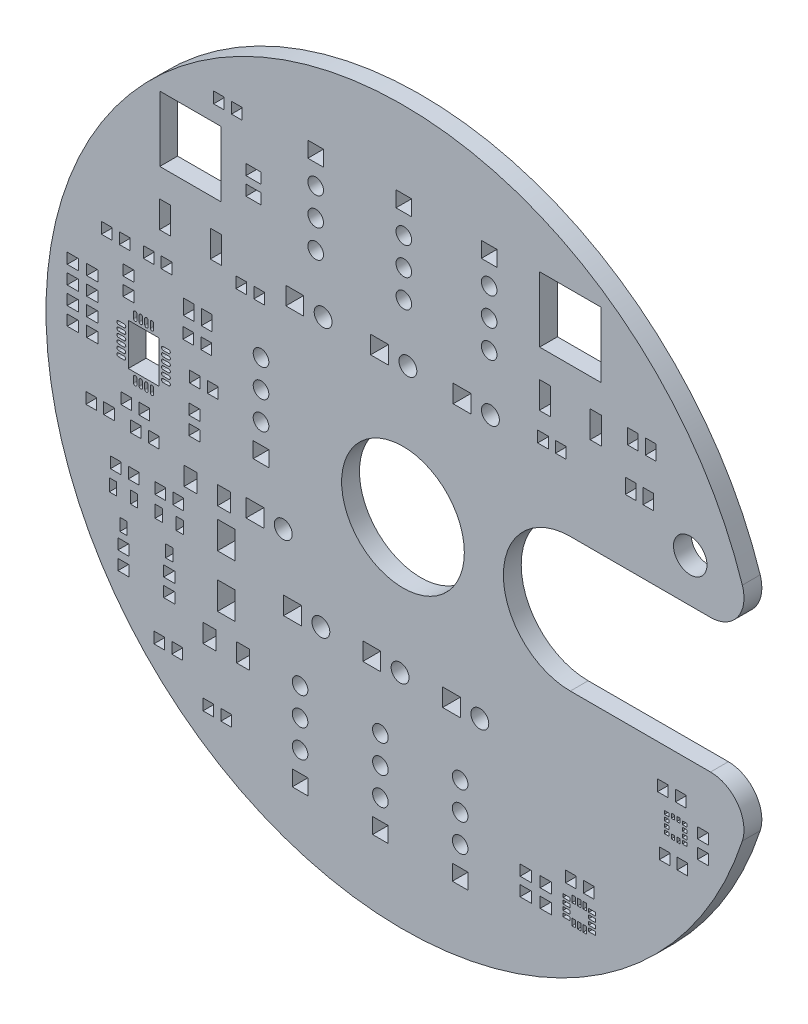
from build123d import *

# Parameters (mm, degrees)
MODEL_R            = 1.5
MODEL_R_2          = 0.7
MODEL_R_3          = 0.8
MODEL_R_4          = 5.5
MODEL_W            = 0.4
MODEL_H            = 0.3
MODEL_W_2          = 0.3
MODEL_H_2          = 0.4
MODEL_W_3          = 0.6
MODEL_H_3          = 0.6
MODEL_W_4          = 0.95
MODEL_H_4          = 1.35
MODEL_W_5          = 2.75
MODEL_H_5          = 3.75
MODEL_W_6          = 0.65
MODEL_H_6          = 1.1
MODEL_W_7          = 1.35
MODEL_H_7          = 0.95
MODEL_W_8          = 1
MODEL_H_8          = 2.4
MODEL_W_9          = 5.5
MODEL_H_9          = 5.85
MODEL_H_10         = 1
MODEL_W_10         = 1.15
MODEL_H_11         = 1.65
MODEL_W_11         = 1.55
MODEL_H_12         = 2.45
MODEL_W_12         = 1.4
MODEL_H_13         = 1.4
MODEL_W_13         = 1.6
MODEL_H_14         = 1.6
BOSS_EXTRU_1_DEPTH = 1.6


with BuildPart() as part:
    # Model → Boss.-Extru.1 (new body)
    with BuildSketch(Plane.XY):
        with BuildLine():
            Line((27.5681, -6), (15, -6))
            ThreePointArc((15, -6), (9, 0), (15, 6))
            Line((15, 6), (27.5681, 6))
            ThreePointArc((27.5681, 6), (29.996378345, 7.238321112), (30.42, 9.931))
            ThreePointArc((30.42, 9.931), (-32.000018141, 0), (30.42, -9.931))
            ThreePointArc((30.42, -9.931), (29.996378346, -7.238321112), (27.5681, -6))
        make_face()
        with Locations((25.75, 9.9)):
            Circle(MODEL_R, mode=Mode.SUBTRACT)
        with Locations((-12.725, 1.025)):
            Circle(MODEL_R_2, mode=Mode.SUBTRACT)
        with Locations((-12.725, 3.525)):
            Circle(MODEL_R_2, mode=Mode.SUBTRACT)
        with Locations((-12.725, 6.025)):
            Circle(MODEL_R_2, mode=Mode.SUBTRACT)
        with Locations((-9.225, -22.7)):
            Circle(MODEL_R_2, mode=Mode.SUBTRACT)
        with Locations((-9.225, -20.2)):
            Circle(MODEL_R_2, mode=Mode.SUBTRACT)
        with Locations((-9.225, -17.7)):
            Circle(MODEL_R_2, mode=Mode.SUBTRACT)
        with Locations((5.125, -22.85)):
            Circle(MODEL_R_2, mode=Mode.SUBTRACT)
        with Locations((5.125, -20.35)):
            Circle(MODEL_R_2, mode=Mode.SUBTRACT)
        with Locations((5.125, -17.85)):
            Circle(MODEL_R_2, mode=Mode.SUBTRACT)
        with Locations((-2.025, -22.8001)):
            Circle(MODEL_R_2, mode=Mode.SUBTRACT)
        with Locations((-2.025, -20.3001)):
            Circle(MODEL_R_2, mode=Mode.SUBTRACT)
        with Locations((-2.025, -17.8001)):
            Circle(MODEL_R_2, mode=Mode.SUBTRACT)
        with Locations((-7.825, 21.7999)):
            Circle(MODEL_R_2, mode=Mode.SUBTRACT)
        with Locations((-7.825, 19.2999)):
            Circle(MODEL_R_2, mode=Mode.SUBTRACT)
        with Locations((-7.825, 16.7999)):
            Circle(MODEL_R_2, mode=Mode.SUBTRACT)
        with Locations((7.725, 21.8)):
            Circle(MODEL_R_2, mode=Mode.SUBTRACT)
        with Locations((7.725, 19.3)):
            Circle(MODEL_R_2, mode=Mode.SUBTRACT)
        with Locations((7.725, 16.8)):
            Circle(MODEL_R_2, mode=Mode.SUBTRACT)
        with Locations((0.075, 21.9)):
            Circle(MODEL_R_2, mode=Mode.SUBTRACT)
        with Locations((0.075, 19.4)):
            Circle(MODEL_R_2, mode=Mode.SUBTRACT)
        with Locations((0.075, 16.9)):
            Circle(MODEL_R_2, mode=Mode.SUBTRACT)
        with Locations((6.89, -12.2)):
            Circle(MODEL_R_3, mode=Mode.SUBTRACT)
        with Locations((-0.26, -12.2)):
            Circle(MODEL_R_3, mode=Mode.SUBTRACT)
        with Locations((-7.36, -12.2)):
            Circle(MODEL_R_3, mode=Mode.SUBTRACT)
        with Locations((-7.16, 11.95)):
            Circle(MODEL_R_3, mode=Mode.SUBTRACT)
        with Locations((0.44, 11.95)):
            Circle(MODEL_R_3, mode=Mode.SUBTRACT)
        with Locations((7.84, 11.85)):
            Circle(MODEL_R_3, mode=Mode.SUBTRACT)
        with Locations((-10.73, -6.3)):
            Circle(MODEL_R_3, mode=Mode.SUBTRACT)
        Circle(MODEL_R_4, mode=Mode.SUBTRACT)
        with Locations((25.25, -12.7)):
            Rectangle(MODEL_W, MODEL_H, mode=Mode.SUBTRACT)
        with Locations((25.25, -12.2)):
            Rectangle(MODEL_W, MODEL_H, mode=Mode.SUBTRACT)
        with Locations((25.25, -11.7)):
            Rectangle(MODEL_W, MODEL_H, mode=Mode.SUBTRACT)
        with Locations((25.25, -11.2)):
            Rectangle(MODEL_W, MODEL_H, mode=Mode.SUBTRACT)
        with Locations((24.7, -11.15)):
            Rectangle(MODEL_W_2, MODEL_H_2, mode=Mode.SUBTRACT)
        with Locations((24.2, -11.15)):
            Rectangle(MODEL_W_2, MODEL_H_2, mode=Mode.SUBTRACT)
        with Locations((23.65, -11.2)):
            Rectangle(MODEL_W, MODEL_H, mode=Mode.SUBTRACT)
        with Locations((23.65, -11.7)):
            Rectangle(MODEL_W, MODEL_H, mode=Mode.SUBTRACT)
        with Locations((23.65, -12.2)):
            Rectangle(MODEL_W, MODEL_H, mode=Mode.SUBTRACT)
        with Locations((23.65, -12.7)):
            Rectangle(MODEL_W, MODEL_H, mode=Mode.SUBTRACT)
        with Locations((24.2, -12.75)):
            Rectangle(MODEL_W_2, MODEL_H_2, mode=Mode.SUBTRACT)
        with Locations((24.7, -12.75)):
            Rectangle(MODEL_W_2, MODEL_H_2, mode=Mode.SUBTRACT)
        with Locations((16.95, -23.7)):
            Rectangle(MODEL_W_3, MODEL_H, mode=Mode.SUBTRACT)
        with Locations((16.95, -23.2)):
            Rectangle(MODEL_W_3, MODEL_H, mode=Mode.SUBTRACT)
        with Locations((16.95, -22.7)):
            Rectangle(MODEL_W_3, MODEL_H, mode=Mode.SUBTRACT)
        with Locations((16.95, -22.2)):
            Rectangle(MODEL_W_3, MODEL_H, mode=Mode.SUBTRACT)
        with Locations((16.3, -22.05)):
            Rectangle(MODEL_W_2, MODEL_H_3, mode=Mode.SUBTRACT)
        with Locations((15.8, -22.05)):
            Rectangle(MODEL_W_2, MODEL_H_3, mode=Mode.SUBTRACT)
        with Locations((15.3, -22.05)):
            Rectangle(MODEL_W_2, MODEL_H_3, mode=Mode.SUBTRACT)
        with Locations((14.65, -22.2)):
            Rectangle(MODEL_W_3, MODEL_H, mode=Mode.SUBTRACT)
        with Locations((14.65, -22.7)):
            Rectangle(MODEL_W_3, MODEL_H, mode=Mode.SUBTRACT)
        with Locations((14.65, -23.2)):
            Rectangle(MODEL_W_3, MODEL_H, mode=Mode.SUBTRACT)
        with Locations((14.65, -23.7)):
            Rectangle(MODEL_W_3, MODEL_H, mode=Mode.SUBTRACT)
        with Locations((15.3, -23.85)):
            Rectangle(MODEL_W_2, MODEL_H_3, mode=Mode.SUBTRACT)
        with Locations((15.8, -23.85)):
            Rectangle(MODEL_W_2, MODEL_H_3, mode=Mode.SUBTRACT)
        with Locations((16.3, -23.85)):
            Rectangle(MODEL_W_2, MODEL_H_3, mode=Mode.SUBTRACT)
        with Locations((-17.6, 6.5)):
            Rectangle(MODEL_W_4, MODEL_H_4, mode=Mode.SUBTRACT)
        with Locations((-19.2, 6.5)):
            Rectangle(MODEL_W_4, MODEL_H_4, mode=Mode.SUBTRACT)
        with BuildLine():
            Line((-21.5, 0), (-21, 0))
            ThreePointArc((-21, 0), (-20.85, -0.15), (-21, -0.3))
            Line((-21, -0.3), (-21.5, -0.3))
            ThreePointArc((-21.5, -0.3), (-21.65, -0.15), (-21.5, 0))
        make_face(mode=Mode.SUBTRACT)
        with BuildLine():
            Line((-21.5, 0.5), (-21, 0.5))
            ThreePointArc((-21, 0.5), (-20.85, 0.35), (-21, 0.2))
            Line((-21, 0.2), (-21.5, 0.2))
            ThreePointArc((-21.5, 0.2), (-21.65, 0.35), (-21.5, 0.5))
        make_face(mode=Mode.SUBTRACT)
        with BuildLine():
            Line((-21.5, 1), (-21, 1))
            ThreePointArc((-21, 1), (-20.85, 0.85), (-21, 0.7))
            Line((-21, 0.7), (-21.5, 0.7))
            ThreePointArc((-21.5, 0.7), (-21.65, 0.85), (-21.5, 1))
        make_face(mode=Mode.SUBTRACT)
        with BuildLine():
            Line((-21.5, 1.5), (-21, 1.5))
            ThreePointArc((-21, 1.5), (-20.85, 1.35), (-21, 1.2))
            Line((-21, 1.2), (-21.5, 1.2))
            ThreePointArc((-21.5, 1.2), (-21.65, 1.35), (-21.5, 1.5))
        make_face(mode=Mode.SUBTRACT)
        with BuildLine():
            Line((-21.5, 2), (-21, 2))
            ThreePointArc((-21, 2), (-20.85, 1.85), (-21, 1.7))
            Line((-21, 1.7), (-21.5, 1.7))
            ThreePointArc((-21.5, 1.7), (-21.65, 1.85), (-21.5, 2))
        make_face(mode=Mode.SUBTRACT)
        with BuildLine():
            Line((-21.5, 2.5), (-21, 2.5))
            ThreePointArc((-21, 2.5), (-20.85, 2.35), (-21, 2.2))
            Line((-21, 2.2), (-21.5, 2.2))
            ThreePointArc((-21.5, 2.2), (-21.65, 2.35), (-21.5, 2.5))
        make_face(mode=Mode.SUBTRACT)
        with BuildLine():
            Line((-22.65, 3.35), (-22.65, 3.85))
            ThreePointArc((-22.65, 3.85), (-22.5, 4), (-22.35, 3.85))
            Line((-22.35, 3.85), (-22.35, 3.35))
            ThreePointArc((-22.35, 3.35), (-22.5, 3.2), (-22.65, 3.35))
        make_face(mode=Mode.SUBTRACT)
        with BuildLine():
            Line((-23.15, 3.35), (-23.15, 3.85))
            ThreePointArc((-23.15, 3.85), (-23, 4), (-22.85, 3.85))
            Line((-22.85, 3.85), (-22.85, 3.35))
            ThreePointArc((-22.85, 3.35), (-23, 3.2), (-23.15, 3.35))
        make_face(mode=Mode.SUBTRACT)
        with BuildLine():
            Line((-23.65, 3.35), (-23.65, 3.85))
            ThreePointArc((-23.65, 3.85), (-23.5, 4), (-23.35, 3.85))
            Line((-23.35, 3.85), (-23.35, 3.35))
            ThreePointArc((-23.35, 3.35), (-23.5, 3.2), (-23.65, 3.35))
        make_face(mode=Mode.SUBTRACT)
        with BuildLine():
            Line((-24.15, 3.35), (-24.15, 3.85))
            ThreePointArc((-24.15, 3.85), (-24, 4), (-23.85, 3.85))
            Line((-23.85, 3.85), (-23.85, 3.35))
            ThreePointArc((-23.85, 3.35), (-24, 3.2), (-24.15, 3.35))
        make_face(mode=Mode.SUBTRACT)
        with BuildLine():
            Line((-25.5, 2.5), (-25, 2.5))
            ThreePointArc((-25, 2.5), (-24.85, 2.35), (-25, 2.2))
            Line((-25, 2.2), (-25.5, 2.2))
            ThreePointArc((-25.5, 2.2), (-25.65, 2.35), (-25.5, 2.5))
        make_face(mode=Mode.SUBTRACT)
        with BuildLine():
            Line((-25.5, 2), (-25, 2))
            ThreePointArc((-25, 2), (-24.85, 1.85), (-25, 1.7))
            Line((-25, 1.7), (-25.5, 1.7))
            ThreePointArc((-25.5, 1.7), (-25.65, 1.85), (-25.5, 2))
        make_face(mode=Mode.SUBTRACT)
        with BuildLine():
            Line((-25.5, 1.5), (-25, 1.5))
            ThreePointArc((-25, 1.5), (-24.85, 1.35), (-25, 1.2))
            Line((-25, 1.2), (-25.5, 1.2))
            ThreePointArc((-25.5, 1.2), (-25.65, 1.35), (-25.5, 1.5))
        make_face(mode=Mode.SUBTRACT)
        with BuildLine():
            Line((-25.5, 1), (-25, 1))
            ThreePointArc((-25, 1), (-24.85, 0.85), (-25, 0.7))
            Line((-25, 0.7), (-25.5, 0.7))
            ThreePointArc((-25.5, 0.7), (-25.65, 0.85), (-25.5, 1))
        make_face(mode=Mode.SUBTRACT)
        with BuildLine():
            Line((-25.5, 0.5), (-25, 0.5))
            ThreePointArc((-25, 0.5), (-24.85, 0.35), (-25, 0.2))
            Line((-25, 0.2), (-25.5, 0.2))
            ThreePointArc((-25.5, 0.2), (-25.65, 0.35), (-25.5, 0.5))
        make_face(mode=Mode.SUBTRACT)
        with BuildLine():
            Line((-25.5, 0), (-25, 0))
            ThreePointArc((-25, 0), (-24.85, -0.15), (-25, -0.3))
            Line((-25, -0.3), (-25.5, -0.3))
            ThreePointArc((-25.5, -0.3), (-25.65, -0.15), (-25.5, 0))
        make_face(mode=Mode.SUBTRACT)
        with BuildLine():
            Line((-24.15, -1.65), (-24.15, -1.15))
            ThreePointArc((-24.15, -1.15), (-24, -1), (-23.85, -1.15))
            Line((-23.85, -1.15), (-23.85, -1.65))
            ThreePointArc((-23.85, -1.65), (-24, -1.8), (-24.15, -1.65))
        make_face(mode=Mode.SUBTRACT)
        with BuildLine():
            Line((-23.65, -1.65), (-23.65, -1.15))
            ThreePointArc((-23.65, -1.15), (-23.5, -1), (-23.35, -1.15))
            Line((-23.35, -1.15), (-23.35, -1.65))
            ThreePointArc((-23.35, -1.65), (-23.5, -1.8), (-23.65, -1.65))
        make_face(mode=Mode.SUBTRACT)
        with BuildLine():
            Line((-23.15, -1.65), (-23.15, -1.15))
            ThreePointArc((-23.15, -1.15), (-23, -1), (-22.85, -1.15))
            Line((-22.85, -1.15), (-22.85, -1.65))
            ThreePointArc((-22.85, -1.65), (-23, -1.8), (-23.15, -1.65))
        make_face(mode=Mode.SUBTRACT)
        with BuildLine():
            Line((-22.65, -1.65), (-22.65, -1.15))
            ThreePointArc((-22.65, -1.15), (-22.5, -1), (-22.35, -1.15))
            Line((-22.35, -1.15), (-22.35, -1.65))
            ThreePointArc((-22.35, -1.65), (-22.5, -1.8), (-22.65, -1.65))
        make_face(mode=Mode.SUBTRACT)
        with Locations((-23.25, 1.1)):
            Rectangle(MODEL_W_5, MODEL_H_5, mode=Mode.SUBTRACT)
        with Locations((-24.1, -10.65)):
            Rectangle(MODEL_W_6, MODEL_H_6, mode=Mode.SUBTRACT)
        with Locations((-26, -10.65)):
            Rectangle(MODEL_W_6, MODEL_H_6, mode=Mode.SUBTRACT)
        with Locations((-25.05, -13.25)):
            Rectangle(MODEL_W_6, MODEL_H_6, mode=Mode.SUBTRACT)
        with Locations((-20, -10.65)):
            Rectangle(MODEL_W_6, MODEL_H_6, mode=Mode.SUBTRACT)
        with Locations((-21.9, -10.65)):
            Rectangle(MODEL_W_6, MODEL_H_6, mode=Mode.SUBTRACT)
        with Locations((-20.95, -13.25)):
            Rectangle(MODEL_W_6, MODEL_H_6, mode=Mode.SUBTRACT)
        with Locations((22, 12.4)):
            Rectangle(MODEL_W_4, MODEL_H_4, mode=Mode.SUBTRACT)
        with Locations((20.4, 12.4)):
            Rectangle(MODEL_W_4, MODEL_H_4, mode=Mode.SUBTRACT)
        with Locations((-13.4, 19.95)):
            Rectangle(MODEL_W_7, MODEL_H_7, mode=Mode.SUBTRACT)
        with Locations((-13.4, 18.35)):
            Rectangle(MODEL_W_7, MODEL_H_7, mode=Mode.SUBTRACT)
        with Locations((20.6, 16.35)):
            Rectangle(MODEL_W_4, MODEL_H_4, mode=Mode.SUBTRACT)
        with Locations((22.2, 16.35)):
            Rectangle(MODEL_W_4, MODEL_H_4, mode=Mode.SUBTRACT)
        with Locations((-21.33, 12.6)):
            Rectangle(MODEL_W_8, MODEL_H_8, mode=Mode.SUBTRACT)
        with Locations((-16.77, 12.6)):
            Rectangle(MODEL_W_8, MODEL_H_8, mode=Mode.SUBTRACT)
        with Locations((-19.05, 19.25)):
            Rectangle(MODEL_W_9, MODEL_H_9, mode=Mode.SUBTRACT)
        with Locations((12.72, 15.6)):
            Rectangle(MODEL_W_8, MODEL_H_8, mode=Mode.SUBTRACT)
        with Locations((17.28, 15.6)):
            Rectangle(MODEL_W_8, MODEL_H_8, mode=Mode.SUBTRACT)
        with Locations((15, 22.25)):
            Rectangle(MODEL_W_9, MODEL_H_9, mode=Mode.SUBTRACT)
        with Locations((-16.5, 24.1)):
            Rectangle(MODEL_W_4, MODEL_H_10, mode=Mode.SUBTRACT)
        with Locations((-14.9, 24.1)):
            Rectangle(MODEL_W_4, MODEL_H_10, mode=Mode.SUBTRACT)
        with Locations((-20.25, -20.5)):
            Rectangle(MODEL_W_4, MODEL_H_10, mode=Mode.SUBTRACT)
        with Locations((-21.85, -20.5)):
            Rectangle(MODEL_W_4, MODEL_H_10, mode=Mode.SUBTRACT)
        with Locations((-17.45, -23.5)):
            Rectangle(MODEL_W_4, MODEL_H_10, mode=Mode.SUBTRACT)
        with Locations((-15.85, -23.5)):
            Rectangle(MODEL_W_4, MODEL_H_10, mode=Mode.SUBTRACT)
        with Locations((-14.5, 10.75)):
            Rectangle(MODEL_W_4, MODEL_H_10, mode=Mode.SUBTRACT)
        with Locations((-12.9, 10.75)):
            Rectangle(MODEL_W_4, MODEL_H_10, mode=Mode.SUBTRACT)
        with Locations((23.3, -9.4)):
            Rectangle(MODEL_W_4, MODEL_H_10, mode=Mode.SUBTRACT)
        with Locations((24.9, -9.4)):
            Rectangle(MODEL_W_4, MODEL_H_10, mode=Mode.SUBTRACT)
        with Locations((25.05, -14.6)):
            Rectangle(MODEL_W_4, MODEL_H_10, mode=Mode.SUBTRACT)
        with Locations((23.45, -14.6)):
            Rectangle(MODEL_W_4, MODEL_H_10, mode=Mode.SUBTRACT)
        with Locations((26.9, -12.9)):
            Rectangle(MODEL_W_8, MODEL_H_7, mode=Mode.SUBTRACT)
        with Locations((26.9, -11.3)):
            Rectangle(MODEL_W_8, MODEL_H_7, mode=Mode.SUBTRACT)
        with Locations((15.05, -20.6)):
            Rectangle(MODEL_W_4, MODEL_H_10, mode=Mode.SUBTRACT)
        with Locations((16.65, -20.6)):
            Rectangle(MODEL_W_4, MODEL_H_10, mode=Mode.SUBTRACT)
        with Locations((11, -23.75)):
            Rectangle(MODEL_W_8, MODEL_H_7, mode=Mode.SUBTRACT)
        with Locations((11, -22.15)):
            Rectangle(MODEL_W_8, MODEL_H_7, mode=Mode.SUBTRACT)
        with Locations((12.8, -23.75)):
            Rectangle(MODEL_W_8, MODEL_H_7, mode=Mode.SUBTRACT)
        with Locations((12.8, -22.15)):
            Rectangle(MODEL_W_8, MODEL_H_7, mode=Mode.SUBTRACT)
        with Locations((-19.25, 4.45)):
            Rectangle(MODEL_W_4, MODEL_H_10, mode=Mode.SUBTRACT)
        with Locations((-17.65, 4.45)):
            Rectangle(MODEL_W_4, MODEL_H_10, mode=Mode.SUBTRACT)
        with Locations((-23.2, -3.4)):
            Rectangle(MODEL_W_4, MODEL_H_10, mode=Mode.SUBTRACT)
        with Locations((-24.8, -3.4)):
            Rectangle(MODEL_W_4, MODEL_H_10, mode=Mode.SUBTRACT)
        with Locations((-26.35, -4.95)):
            Rectangle(MODEL_W_4, MODEL_H_10, mode=Mode.SUBTRACT)
        with Locations((-27.95, -4.95)):
            Rectangle(MODEL_W_4, MODEL_H_10, mode=Mode.SUBTRACT)
        with Locations((-24.6, 6.65)):
            Rectangle(MODEL_W_8, MODEL_H_7, mode=Mode.SUBTRACT)
        with Locations((-24.6, 5.05)):
            Rectangle(MODEL_W_8, MODEL_H_7, mode=Mode.SUBTRACT)
        with Locations((-17.05, 1.35)):
            Rectangle(MODEL_W_4, MODEL_H_10, mode=Mode.SUBTRACT)
        with Locations((-18.65, 1.35)):
            Rectangle(MODEL_W_4, MODEL_H_10, mode=Mode.SUBTRACT)
        with Locations((-18.7, -2.8)):
            Rectangle(MODEL_W_8, MODEL_H_7, mode=Mode.SUBTRACT)
        with Locations((-18.7, -1.2)):
            Rectangle(MODEL_W_8, MODEL_H_7, mode=Mode.SUBTRACT)
        with Locations((-22.35, -5.15)):
            Rectangle(MODEL_W_4, MODEL_H_10, mode=Mode.SUBTRACT)
        with Locations((-23.95, -5.15)):
            Rectangle(MODEL_W_4, MODEL_H_10, mode=Mode.SUBTRACT)
        with Locations((-29.6, 0.25)):
            Rectangle(MODEL_W_8, MODEL_H_7, mode=Mode.SUBTRACT)
        with Locations((-29.6, 1.85)):
            Rectangle(MODEL_W_8, MODEL_H_7, mode=Mode.SUBTRACT)
        with Locations((-27.85, 0.25)):
            Rectangle(MODEL_W_8, MODEL_H_7, mode=Mode.SUBTRACT)
        with Locations((-27.85, 1.85)):
            Rectangle(MODEL_W_8, MODEL_H_7, mode=Mode.SUBTRACT)
        with Locations((-29.6, 3.45)):
            Rectangle(MODEL_W_8, MODEL_H_7, mode=Mode.SUBTRACT)
        with Locations((-29.6, 5.05)):
            Rectangle(MODEL_W_8, MODEL_H_7, mode=Mode.SUBTRACT)
        with Locations((-27.85, 3.45)):
            Rectangle(MODEL_W_8, MODEL_H_7, mode=Mode.SUBTRACT)
        with Locations((-27.85, 5.05)):
            Rectangle(MODEL_W_8, MODEL_H_7, mode=Mode.SUBTRACT)
        with Locations((-22.8, 8.95)):
            Rectangle(MODEL_W_4, MODEL_H_10, mode=Mode.SUBTRACT)
        with Locations((-21.2, 8.95)):
            Rectangle(MODEL_W_4, MODEL_H_10, mode=Mode.SUBTRACT)
        with Locations((-26.55, 8.95)):
            Rectangle(MODEL_W_4, MODEL_H_10, mode=Mode.SUBTRACT)
        with Locations((-24.95, 8.95)):
            Rectangle(MODEL_W_4, MODEL_H_10, mode=Mode.SUBTRACT)
        with Locations((-24.15, -8.85)):
            Rectangle(MODEL_W_4, MODEL_H_10, mode=Mode.SUBTRACT)
        with Locations((-25.75, -8.85)):
            Rectangle(MODEL_W_4, MODEL_H_10, mode=Mode.SUBTRACT)
        with Locations((-25.05, -16.45)):
            Rectangle(MODEL_W_8, MODEL_H_7, mode=Mode.SUBTRACT)
        with Locations((-25.05, -14.85)):
            Rectangle(MODEL_W_8, MODEL_H_7, mode=Mode.SUBTRACT)
        with Locations((-20.15, -8.85)):
            Rectangle(MODEL_W_4, MODEL_H_10, mode=Mode.SUBTRACT)
        with Locations((-21.75, -8.85)):
            Rectangle(MODEL_W_4, MODEL_H_10, mode=Mode.SUBTRACT)
        with Locations((-20.95, -16.5)):
            Rectangle(MODEL_W_8, MODEL_H_7, mode=Mode.SUBTRACT)
        with Locations((-20.95, -14.9)):
            Rectangle(MODEL_W_8, MODEL_H_7, mode=Mode.SUBTRACT)
        with Locations((14.15, 12.3)):
            Rectangle(MODEL_W_4, MODEL_H_10, mode=Mode.SUBTRACT)
        with Locations((12.55, 12.3)):
            Rectangle(MODEL_W_4, MODEL_H_10, mode=Mode.SUBTRACT)
        with Locations((-17.35, -17.95)):
            Rectangle(MODEL_W_10, MODEL_H_11, mode=Mode.SUBTRACT)
        with Locations((-14.35, -17.95)):
            Rectangle(MODEL_W_10, MODEL_H_11, mode=Mode.SUBTRACT)
        with Locations((-19.05, -6.6)):
            Rectangle(MODEL_W_10, MODEL_H_11, mode=Mode.SUBTRACT)
        with Locations((-16.05, -6.6)):
            Rectangle(MODEL_W_10, MODEL_H_11, mode=Mode.SUBTRACT)
        with Locations((-15.85, -9.7)):
            Rectangle(MODEL_W_11, MODEL_H_12, mode=Mode.SUBTRACT)
        with Locations((-15.85, -14.4)):
            Rectangle(MODEL_W_11, MODEL_H_12, mode=Mode.SUBTRACT)
        with Locations((-12.725, -1.475)):
            Rectangle(MODEL_W_12, MODEL_H_13, mode=Mode.SUBTRACT)
        with Locations((-9.225, -25.2)):
            Rectangle(MODEL_W_12, MODEL_H_13, mode=Mode.SUBTRACT)
        with Locations((5.125, -25.35)):
            Rectangle(MODEL_W_12, MODEL_H_13, mode=Mode.SUBTRACT)
        with Locations((-2.025, -25.3001)):
            Rectangle(MODEL_W_12, MODEL_H_13, mode=Mode.SUBTRACT)
        with Locations((-7.825, 24.2999)):
            Rectangle(MODEL_W_12, MODEL_H_13, mode=Mode.SUBTRACT)
        with Locations((7.725, 24.3)):
            Rectangle(MODEL_W_12, MODEL_H_13, mode=Mode.SUBTRACT)
        with Locations((0.075, 24.4)):
            Rectangle(MODEL_W_12, MODEL_H_13, mode=Mode.SUBTRACT)
        with Locations((4.35, -12.2)):
            Rectangle(MODEL_W_13, MODEL_H_14, mode=Mode.SUBTRACT)
        with Locations((-2.8, -12.2)):
            Rectangle(MODEL_W_13, MODEL_H_14, mode=Mode.SUBTRACT)
        with Locations((-9.9, -12.2)):
            Rectangle(MODEL_W_13, MODEL_H_14, mode=Mode.SUBTRACT)
        with Locations((-9.7, 11.95)):
            Rectangle(MODEL_W_13, MODEL_H_14, mode=Mode.SUBTRACT)
        with Locations((-2.1, 11.95)):
            Rectangle(MODEL_W_13, MODEL_H_14, mode=Mode.SUBTRACT)
        with Locations((5.3, 11.85)):
            Rectangle(MODEL_W_13, MODEL_H_14, mode=Mode.SUBTRACT)
        with Locations((-13.27, -6.3)):
            Rectangle(MODEL_W_13, MODEL_H_14, mode=Mode.SUBTRACT)
    extrude(amount=BOSS_EXTRU_1_DEPTH)


solid = part.part
